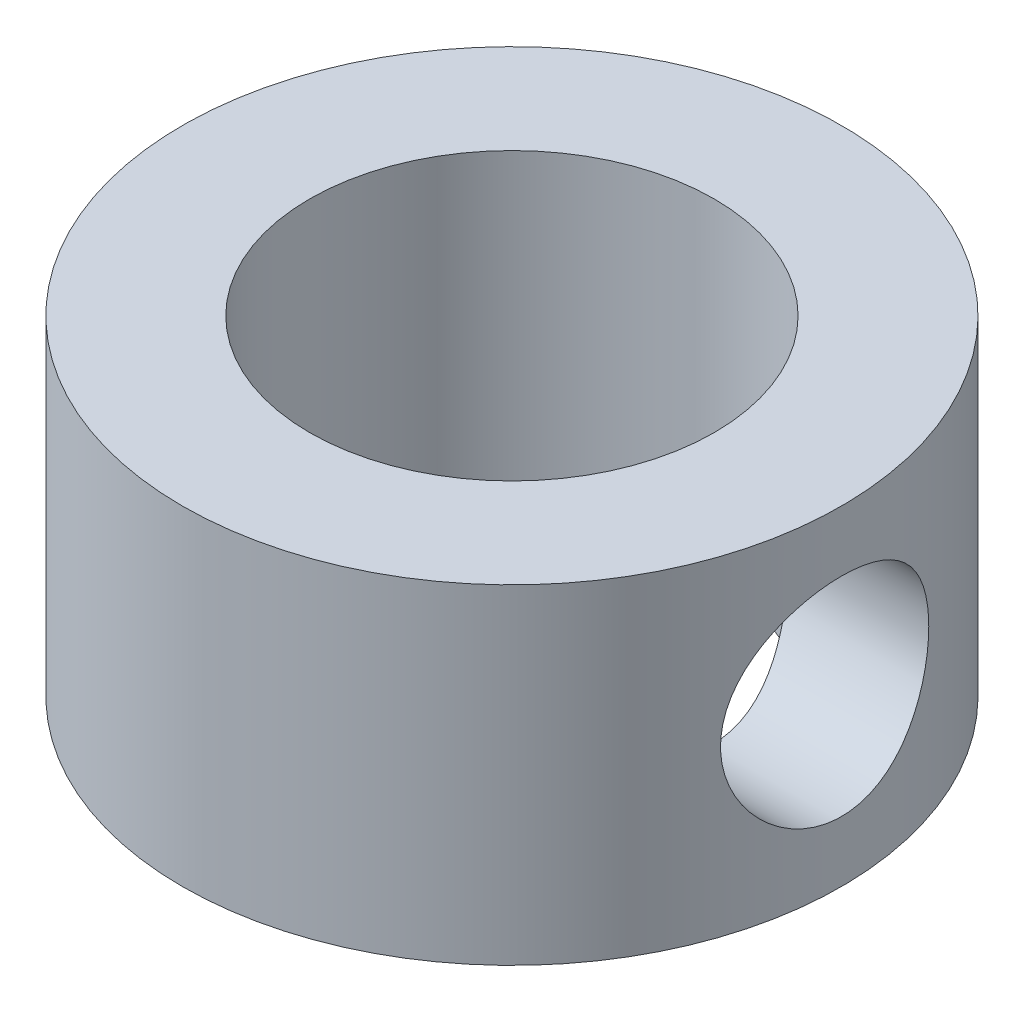
from build123d import *

# Parameters (mm, degrees)
SKETCH_1_R      = 5
SKETCH_1_R_2    = 3.07
EXTRUDE_1_DEPTH = 5
SKETCH_2_W      = 11.338543919
SKETCH_2_H      = 3.370146556
EXTRUDE_2_DEPTH = 7
SKETCH_3_R      = 1.58
EXTRUDE_3_DEPTH = 6


with BuildPart() as part:
    # 草图1 → 凸台-拉伸1 (new body)
    with BuildSketch(Plane(origin=(0, 0, 0), x_dir=(1, 0, 0), z_dir=(0, 1, 0))):
        with Locations((0, 0.826021493)):
            Circle(SKETCH_1_R)
        with Locations((0, 0.826021493)):
            Circle(SKETCH_1_R_2, mode=Mode.SUBTRACT)
    extrude(amount=EXTRUDE_1_DEPTH)


with BuildPart() as body_2:
    # 草图2 → 凸台-拉伸2 (new body)
    with BuildSketch(Plane(origin=(0, 5, 0), x_dir=(1, 0, 0), z_dir=(0, 1, 0))):
        with Locations((-0.160637922, 0.629667615)):
            Rectangle(SKETCH_2_W, SKETCH_2_H)
    extrude(amount=-EXTRUDE_2_DEPTH)


with BuildPart() as body_3:
    # 草图3 → 凸台-拉伸3 (new body)
    with BuildSketch(Plane(origin=(5.508634037, 0, 0), x_dir=(0, 0, -1), z_dir=(1, 0, 0))):
        with Locations((0.826021493, 2.5)):
            Circle(SKETCH_3_R)
    extrude(amount=-EXTRUDE_3_DEPTH)


with BuildPart() as part_1:
    add(part.part)

    # Combine 1: cut body 3
    add(body_3.part, mode=Mode.SUBTRACT)


solid = part_1.part
